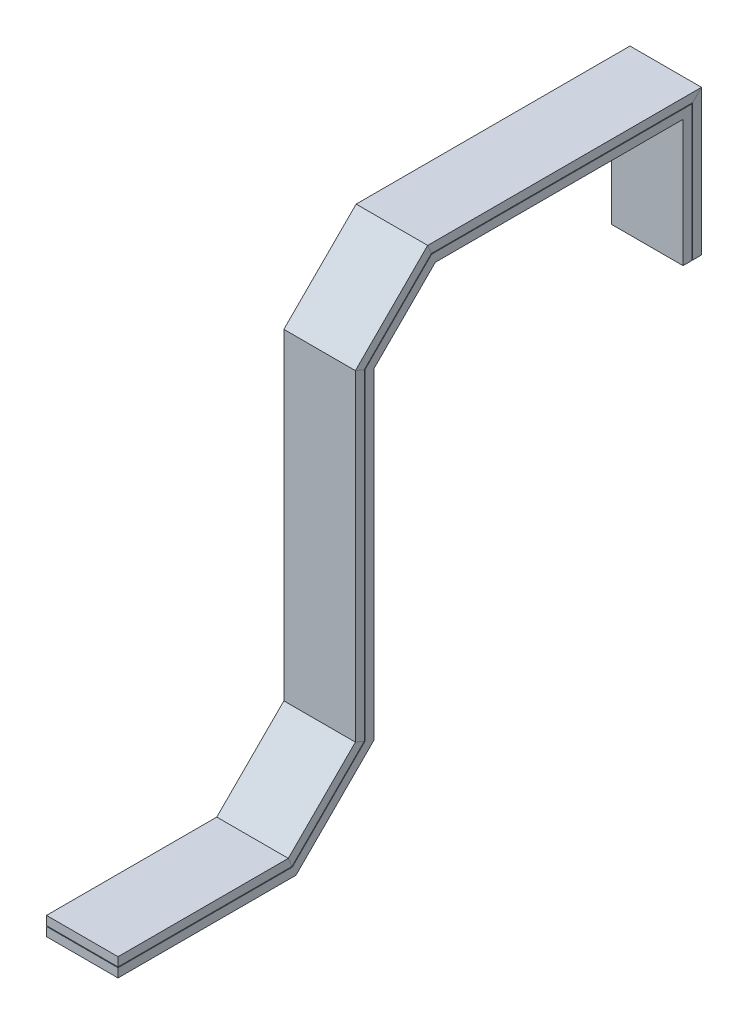
from build123d import *

# Parameters (mm, degrees)
CROQUIS1_W              = 50.8
CROQUIS1_H              = 6.31
SALIENTE_EXTRUIR1_DEPTH = 50.8


with BuildPart() as part:
    # Barrer1: sweep along a curve in space
    with BuildLine() as barrer1_path:
        Line((0, 0, 0), (0, 100, 0))
        Line((0, 100, 0), (0, 100, 190))
        Line((0, 100, 190), (0, 50.502525317, 239.497474683))
        Line((0, 50.502525317, 239.497474683), (0, -178.002525317, 239.497474683))
        Line((0, -178.002525317, 239.497474683), (0, -227.5, 288.994949366))
        Line((0, -227.5, 288.994949366), (0, -227.5, 411.224949366))
    # Croquis1 → Barrer1 (sweep)
    with BuildSketch(Plane(origin=(0, 0, 0), x_dir=(1, 0, 0), z_dir=(0, 1, 0))):
        Rectangle(CROQUIS1_W, CROQUIS1_H)
    sweep(path=barrer1_path.line, transition=Transition.RIGHT)


with BuildPart() as body_2:
    # Croquis2 → Saliente-Extruir1 (new body)
    with BuildSketch(Plane.ZY.offset(25.4)):
        Polygon((3.655, 0), (3.655, 96.345), (188.48604943, 96.345), (235.842474683, 48.988574746), (235.842474683, -179.516475887), (287.480998796, -231.155), (411.224949366, -231.155), (411.224949366, -237.465), (284.867311217, -237.465), (229.532474683, -182.130163466), (229.532474683, 46.374887168), (185.872361851, 90.035), (9.965, 90.035), (9.965, 0), align=None)
    extrude(amount=-SALIENTE_EXTRUIR1_DEPTH)


solid = Compound([part.part, body_2.part])
